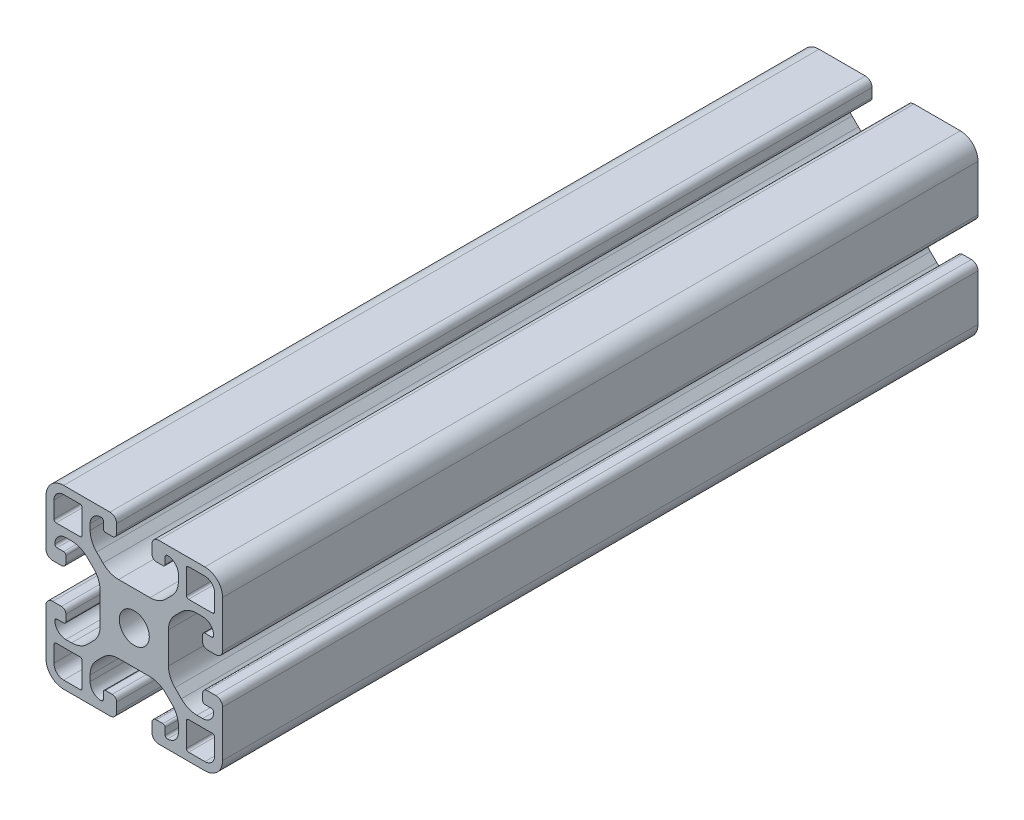
from build123d import *

# Parameters (mm, degrees)
ESQUISSE1_R        = 3.4
BOSS_EXTRU_1_DEPTH = 171.15


with BuildPart() as part:
    # Esquisse1 → Boss.-Extru.1 (new body)
    with BuildSketch(Plane(origin=(0, 0, -30), x_dir=(-1, 0, 0), z_dir=(0, 0, -1))):
        with BuildLine():
            Line((-4.5, 15), (-4.5, 13.5))
            ThreePointArc((-4.5, 13.5), (-4.353553391, 13.146446609), (-4, 13))
            Line((-4, 13), (-2.5, 13))
            ThreePointArc((-2.5, 13), (-2.146446609, 12.853553391), (-2, 12.5))
            ThreePointArc((-2, 12.5), (-2.732233047, 10.732233047), (-4.5, 10))
            Line((-4.5, 10), (-5.807611845, 10))
            ThreePointArc((-5.807611845, 10), (-7.721029006, 10.380602337), (-9.343145751, 11.464466094))
            Line((-9.343145751, 11.464466094), (-10.785533906, 12.906854249))
            ThreePointArc((-10.785533906, 12.906854249), (-11.869397663, 14.528970994), (-12.25, 16.442388155))
            Line((-12.25, 16.442388155), (-12.25, 23.557611845))
            ThreePointArc((-12.25, 23.557611845), (-11.869397663, 25.471029006), (-10.785533906, 27.093145751))
            Line((-10.785533906, 27.093145751), (-9.343145751, 28.535533906))
            ThreePointArc((-9.343145751, 28.535533906), (-7.721029006, 29.619397663), (-5.807611845, 30))
            Line((-5.807611845, 30), (-4.5, 30))
            ThreePointArc((-4.5, 30), (-2.732233047, 29.267766953), (-2, 27.5))
            ThreePointArc((-2, 27.5), (-2.146446609, 27.146446609), (-2.5, 27))
            Line((-2.5, 27), (-4, 27))
            ThreePointArc((-4, 27), (-4.353553391, 26.853553391), (-4.5, 26.5))
            Line((-4.5, 26.5), (-4.5, 25))
            ThreePointArc((-4.5, 25), (-4.207106781, 24.292893219), (-3.5, 24))
            Line((-3.5, 24), (-1.5, 24))
            ThreePointArc((-1.5, 24), (-0.439339828, 24.439339828), (0, 25.5))
            Line((0, 25.5), (0, 36))
            ThreePointArc((0, 36), (-1.171572875, 38.828427125), (-4, 40))
            Line((-4, 40), (-14.5, 40))
            ThreePointArc((-14.5, 40), (-15.560660172, 39.560660172), (-16, 38.5))
            Line((-16, 38.5), (-16, 36.5))
            ThreePointArc((-16, 36.5), (-15.707106781, 35.792893219), (-15, 35.5))
            Line((-15, 35.5), (-13.5, 35.5))
            ThreePointArc((-13.5, 35.5), (-13.146446609, 35.646446609), (-13, 36))
            Line((-13, 36), (-13, 37.5))
            ThreePointArc((-13, 37.5), (-12.853553391, 37.853553391), (-12.5, 38))
            ThreePointArc((-12.5, 38), (-10.732233047, 37.267766953), (-10, 35.5))
            Line((-10, 35.5), (-10, 34.192388155))
            ThreePointArc((-10, 34.192388155), (-10.380602337, 32.278970994), (-11.464466094, 30.656854249))
            Line((-11.464466094, 30.656854249), (-12.906854249, 29.214466094))
            ThreePointArc((-12.906854249, 29.214466094), (-14.528970994, 28.130602337), (-16.442388155, 27.75))
            Line((-16.442388155, 27.75), (-23.557611845, 27.75))
            ThreePointArc((-23.557611845, 27.75), (-25.471029006, 28.130602337), (-27.093145751, 29.214466094))
            Line((-27.093145751, 29.214466094), (-28.535533906, 30.656854249))
            ThreePointArc((-28.535533906, 30.656854249), (-29.619397663, 32.278970994), (-30, 34.192388155))
            Line((-30, 34.192388155), (-30, 35.5))
            ThreePointArc((-30, 35.5), (-29.267766953, 37.267766953), (-27.5, 38))
            ThreePointArc((-27.5, 38), (-27.146446609, 37.853553391), (-27, 37.5))
            Line((-27, 37.5), (-27, 36))
            ThreePointArc((-27, 36), (-26.853553391, 35.646446609), (-26.5, 35.5))
            Line((-26.5, 35.5), (-25, 35.5))
            ThreePointArc((-25, 35.5), (-24.292893219, 35.792893219), (-24, 36.5))
            Line((-24, 36.5), (-24, 38.5))
            ThreePointArc((-24, 38.5), (-24.439339828, 39.560660172), (-25.5, 40))
            Line((-25.5, 40), (-36, 40))
            ThreePointArc((-36, 40), (-38.828427125, 38.828427125), (-40, 36))
            Line((-40, 36), (-40, 25.5))
            ThreePointArc((-40, 25.5), (-39.560660172, 24.439339828), (-38.5, 24))
            Line((-38.5, 24), (-36.5, 24))
            ThreePointArc((-36.5, 24), (-35.792893219, 24.292893219), (-35.5, 25))
            Line((-35.5, 25), (-35.5, 26.5))
            ThreePointArc((-35.5, 26.5), (-35.646446609, 26.853553391), (-36, 27))
            Line((-36, 27), (-37.5, 27))
            ThreePointArc((-37.5, 27), (-37.853553391, 27.146446609), (-38, 27.5))
            ThreePointArc((-38, 27.5), (-37.267766953, 29.267766953), (-35.5, 30))
            Line((-35.5, 30), (-34.192388155, 30))
            ThreePointArc((-34.192388155, 30), (-32.278970994, 29.619397663), (-30.656854249, 28.535533906))
            Line((-30.656854249, 28.535533906), (-29.214466094, 27.093145751))
            ThreePointArc((-29.214466094, 27.093145751), (-28.130602337, 25.471029006), (-27.75, 23.557611845))
            Line((-27.75, 23.557611845), (-27.75, 16.442388155))
            ThreePointArc((-27.75, 16.442388155), (-28.130602337, 14.528970994), (-29.214466094, 12.906854249))
            Line((-29.214466094, 12.906854249), (-30.656854249, 11.464466094))
            ThreePointArc((-30.656854249, 11.464466094), (-32.278970994, 10.380602337), (-34.192388155, 10))
            Line((-34.192388155, 10), (-35.5, 10))
            ThreePointArc((-35.5, 10), (-37.267766953, 10.732233047), (-38, 12.5))
            ThreePointArc((-38, 12.5), (-37.853553391, 12.853553391), (-37.5, 13))
            Line((-37.5, 13), (-36, 13))
            ThreePointArc((-36, 13), (-35.646446609, 13.146446609), (-35.5, 13.5))
            Line((-35.5, 13.5), (-35.5, 15))
            ThreePointArc((-35.5, 15), (-35.792893219, 15.707106781), (-36.5, 16))
            Line((-36.5, 16), (-38.5, 16))
            ThreePointArc((-38.5, 16), (-39.560660172, 15.560660172), (-40, 14.5))
            Line((-40, 14.5), (-40, 4))
            ThreePointArc((-40, 4), (-38.828427125, 1.171572875), (-36, 0))
            Line((-36, 0), (-25.5, 0))
            ThreePointArc((-25.5, 0), (-24.439339828, 0.439339828), (-24, 1.5))
            Line((-24, 1.5), (-24, 3.5))
            ThreePointArc((-24, 3.5), (-24.292893219, 4.207106781), (-25, 4.5))
            Line((-25, 4.5), (-26.5, 4.5))
            ThreePointArc((-26.5, 4.5), (-26.853553391, 4.353553391), (-27, 4))
            Line((-27, 4), (-27, 2.5))
            ThreePointArc((-27, 2.5), (-27.146446609, 2.146446609), (-27.5, 2))
            ThreePointArc((-27.5, 2), (-29.267766953, 2.732233047), (-30, 4.5))
            Line((-30, 4.5), (-30, 5.807611845))
            ThreePointArc((-30, 5.807611845), (-29.619397663, 7.721029006), (-28.535533906, 9.343145751))
            Line((-28.535533906, 9.343145751), (-27.093145751, 10.785533906))
            ThreePointArc((-27.093145751, 10.785533906), (-25.471029006, 11.869397663), (-23.557611845, 12.25))
            Line((-23.557611845, 12.25), (-16.442388155, 12.25))
            ThreePointArc((-16.442388155, 12.25), (-14.528970994, 11.869397663), (-12.906854249, 10.785533906))
            Line((-12.906854249, 10.785533906), (-11.464466094, 9.343145751))
            ThreePointArc((-11.464466094, 9.343145751), (-10.380602337, 7.721029006), (-10, 5.807611845))
            Line((-10, 5.807611845), (-10, 4.5))
            ThreePointArc((-10, 4.5), (-10.732233047, 2.732233047), (-12.5, 2))
            ThreePointArc((-12.5, 2), (-12.853553391, 2.146446609), (-13, 2.5))
            Line((-13, 2.5), (-13, 4))
            ThreePointArc((-13, 4), (-13.146446609, 4.353553391), (-13.5, 4.5))
            Line((-13.5, 4.5), (-15, 4.5))
            ThreePointArc((-15, 4.5), (-15.707106781, 4.207106781), (-16, 3.5))
            Line((-16, 3.5), (-16, 1.5))
            ThreePointArc((-16, 1.5), (-15.560660172, 0.439339828), (-14.5, 0))
            Line((-14.5, 0), (-4, 0))
            ThreePointArc((-4, 0), (-1.171572875, 1.171572875), (0, 4))
            Line((0, 4), (0, 14.5))
            ThreePointArc((0, 14.5), (-0.439339828, 15.560660172), (-1.5, 16))
            Line((-1.5, 16), (-3.5, 16))
            ThreePointArc((-3.5, 16), (-4.207106781, 15.707106781), (-4.5, 15))
        make_face()
        with Locations(Location((-20, 20, 0), (0, 0, 180))):
            Circle(ESQUISSE1_R, mode=Mode.SUBTRACT)
        with BuildLine():
            Line((-4, 1.8), (-7.7, 1.8))
            ThreePointArc((-7.7, 1.8), (-8.053553391, 1.946446609), (-8.2, 2.3))
            Line((-8.2, 2.3), (-8.2, 7.7))
            ThreePointArc((-8.2, 7.7), (-8.053553391, 8.053553391), (-7.7, 8.2))
            Line((-7.7, 8.2), (-2.3, 8.2))
            ThreePointArc((-2.3, 8.2), (-1.946446609, 8.053553391), (-1.8, 7.7))
            Line((-1.8, 7.7), (-1.8, 4))
            ThreePointArc((-1.8, 4), (-2.444365081, 2.444365081), (-4, 1.8))
        make_face(mode=Mode.SUBTRACT)
        with BuildLine():
            Line((-38.2, 4), (-38.2, 7.7))
            ThreePointArc((-38.2, 7.7), (-38.053553391, 8.053553391), (-37.7, 8.2))
            Line((-37.7, 8.2), (-32.3, 8.2))
            ThreePointArc((-32.3, 8.2), (-31.946446609, 8.053553391), (-31.8, 7.7))
            Line((-31.8, 7.7), (-31.8, 2.3))
            ThreePointArc((-31.8, 2.3), (-31.946446609, 1.946446609), (-32.3, 1.8))
            Line((-32.3, 1.8), (-36, 1.8))
            ThreePointArc((-36, 1.8), (-37.555634919, 2.444365081), (-38.2, 4))
        make_face(mode=Mode.SUBTRACT)
        with BuildLine():
            Line((-36, 38.2), (-32.3, 38.2))
            ThreePointArc((-32.3, 38.2), (-31.946446609, 38.053553391), (-31.8, 37.7))
            Line((-31.8, 37.7), (-31.8, 32.3))
            ThreePointArc((-31.8, 32.3), (-31.946446609, 31.946446609), (-32.3, 31.8))
            Line((-32.3, 31.8), (-37.7, 31.8))
            ThreePointArc((-37.7, 31.8), (-38.053553391, 31.946446609), (-38.2, 32.3))
            Line((-38.2, 32.3), (-38.2, 36))
            ThreePointArc((-38.2, 36), (-37.555634919, 37.555634919), (-36, 38.2))
        make_face(mode=Mode.SUBTRACT)
        with BuildLine():
            Line((-1.8, 36), (-1.8, 32.3))
            ThreePointArc((-1.8, 32.3), (-1.946446609, 31.946446609), (-2.3, 31.8))
            Line((-2.3, 31.8), (-7.7, 31.8))
            ThreePointArc((-7.7, 31.8), (-8.053553391, 31.946446609), (-8.2, 32.3))
            Line((-8.2, 32.3), (-8.2, 37.7))
            ThreePointArc((-8.2, 37.7), (-8.053553391, 38.053553391), (-7.7, 38.2))
            Line((-7.7, 38.2), (-4, 38.2))
            ThreePointArc((-4, 38.2), (-2.444365081, 37.555634919), (-1.8, 36))
        make_face(mode=Mode.SUBTRACT)
    extrude(amount=-BOSS_EXTRU_1_DEPTH)


solid = part.part
